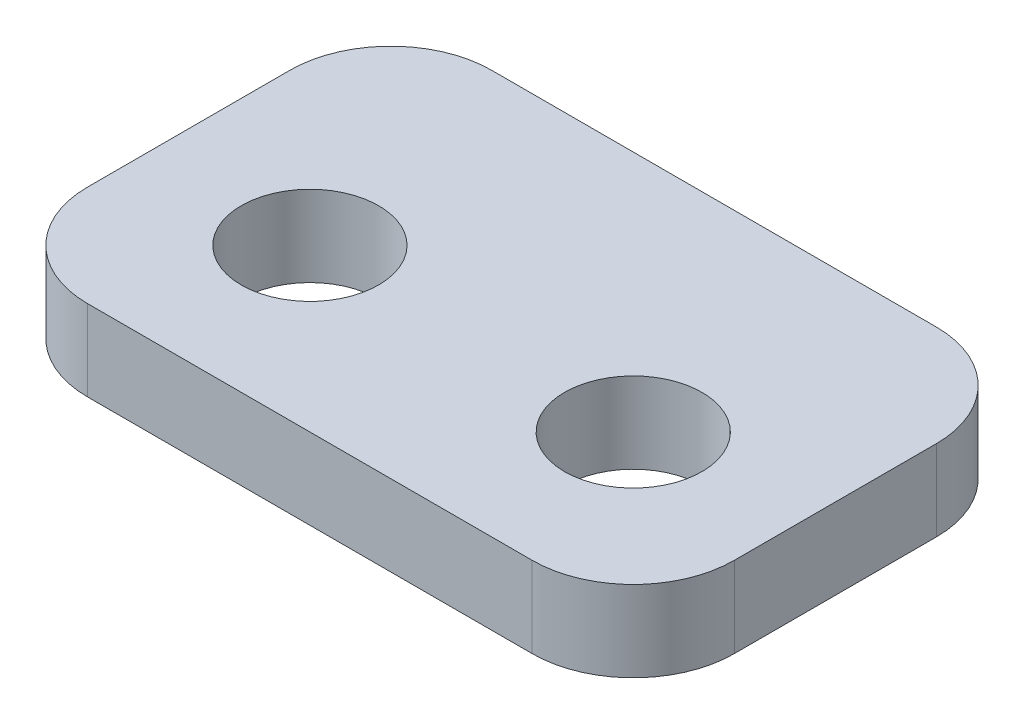
from build123d import *

# Parameters (mm, degrees)
SKETCH1_W           = 16
SKETCH1_H           = 10
SKETCH1_R           = 1.7
BOSS_EXTRUDE1_DEPTH = 2
FILLET1_R           = 2.5


with BuildPart() as part:
    # Sketch1 → Boss-Extrude1 (new body)
    with BuildSketch(Plane(origin=(0, 0, 0), x_dir=(1, 0, 0), z_dir=(0, 1, 0))):
        with Locations((0, 1)):
            Rectangle(SKETCH1_W, SKETCH1_H)
        with Locations(Location((-4, 0, 0), (0, 0, 270))):
            Circle(SKETCH1_R, mode=Mode.SUBTRACT)
        with Locations(Location((4, 0, 0), (0, 0, 270))):
            Circle(SKETCH1_R, mode=Mode.SUBTRACT)
    extrude(amount=BOSS_EXTRUDE1_DEPTH)

    # Fillet1
    fillet1_edges = [part.edges().sort_by_distance(p)[0] for p in [
        (8, 1, 4),
        (-8, 1, 4),
        (-8, 1, -6),
        (8, 1, -6),
    ]]
    fillet(fillet1_edges, radius=FILLET1_R)


solid = part.part
